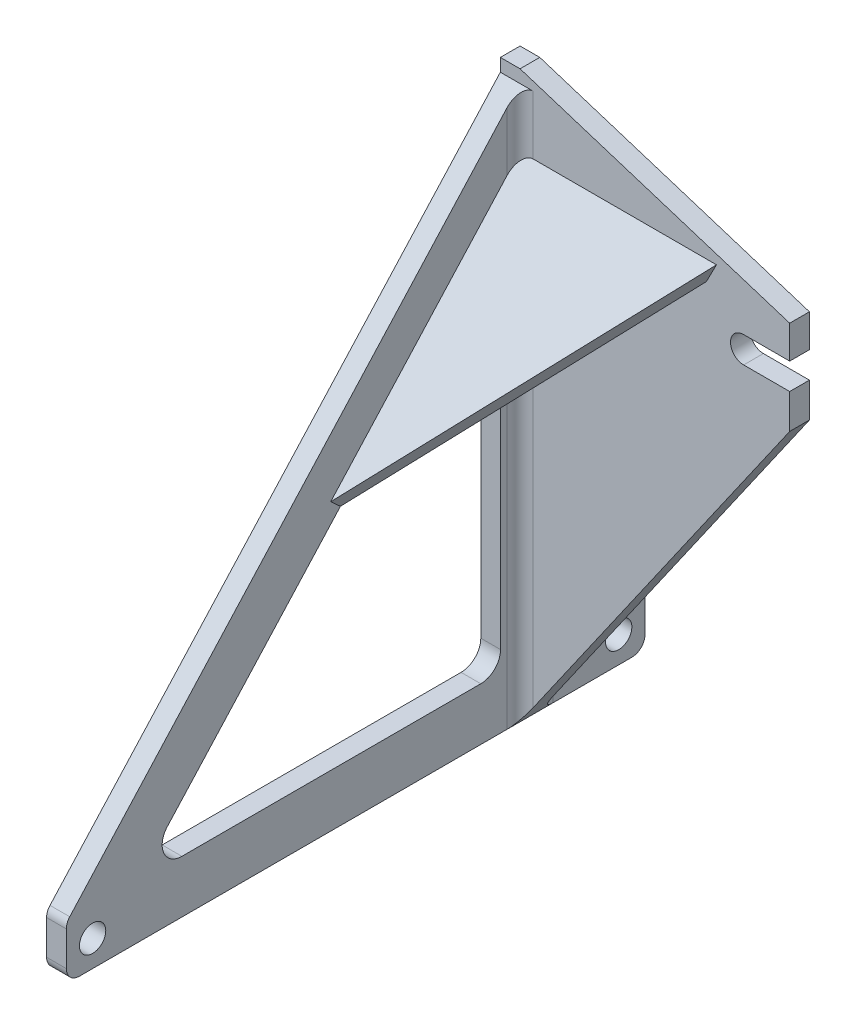
from build123d import *

# Parameters (mm, degrees)
SKETCH_1_R          = 2
EXTRUDE_1_DEPTH     = 3
SKETCH_2_W          = 3
SKETCH_2_H          = 86
EXTRUDE_2_DEPTH     = 44
CUT_EXTRUDE_1_DEPTH = 3
FILLET_1_R          = 2
RIB_2_REACH         = 105.226
SKETCH_8_WALL_W     = 259.89004629
SKETCH_8_WALL_H     = 2
FILLET_2_R          = 2


with BuildPart() as part:
    # Эскиз1 → Бобышка-Вытянуть1 (new body)
    with BuildSketch(Plane(origin=(0, 0, 0), x_dir=(0, 0, -1), z_dir=(1, 0, 0))):
        Polygon((-44, 0), (44, 0), (44, 8), (25, 84.048968678), (-44, 8), align=None)
        with Locations((-40, 4)):
            Circle(SKETCH_1_R, mode=Mode.SUBTRACT)
        with Locations((40, 4)):
            Circle(SKETCH_1_R, mode=Mode.SUBTRACT)
        with BuildLine():
            Line((-28.646958906, 13.01585119), (16.806444582, 63.112727395))
            ThreePointArc((16.806444582, 63.112727395), (20.10865764, 63.895569238), (22.028233046, 61.096876205))
            Line((22.028233046, 61.096876205), (22.028233046, 11))
            ThreePointArc((22.028233046, 11), (21.14955339, 8.878679656), (19.028233046, 8))
            Line((19.028233046, 8), (-26.425170442, 8))
            ThreePointArc((-26.425170442, 8), (-29.168120821, 9.785000735), (-28.646958906, 13.01585119))
        make_face(mode=Mode.SUBTRACT)
    extrude(amount=EXTRUDE_1_DEPTH)

    # Эскиз2 → Бобышка-Вытянуть2 (add)
    with BuildSketch(Plane(origin=(0, 0, 0), x_dir=(0, 0, -1), z_dir=(1, 0, 0))):
        with Locations((26.5, 43)):
            Rectangle(SKETCH_2_W, SKETCH_2_H)
    extrude(amount=EXTRUDE_2_DEPTH)

    # Эскиз3 → Вырез-Вытянуть1 (cut)
    with BuildSketch(Plane.XY.offset(-25)):
        with BuildLine():
            Line((3, 86), (44, 73))
            Line((44, 73), (44, 68))
            Line((44, 68), (37, 68))
            ThreePointArc((37, 68), (35, 66), (37, 64))
            Line((37, 64), (44, 64))
            Line((44, 64), (47.670015823, 64))
            Line((47.670015823, 64), (3, 0))
            Line((3, 0), (48.684950213, 0))
            Line((48.684950213, 0), (53.414147697, 0))
            Line((53.414147697, 0), (53.414147697, 86))
            Line((53.414147697, 86), (3, 86))
        make_face()
    extrude(amount=-CUT_EXTRUDE_1_DEPTH, mode=Mode.SUBTRACT)

    # Скругление1
    fillet_1_edges = [part.edges().sort_by_distance(p)[0] for p in [
        (3, 36.020618391, -28),
        (3, 42.024484339, -25),
    ]]
    fillet(fillet_1_edges, radius=FILLET_1_R)

    # Эскиз8 wall → Ребро2 (add, up to next)
    with BuildSketch(Plane(origin=(17.70715676, 57.665222316, -11.863868016), x_dir=(0.571832945578, 0.60756293308, -0.551248006526), z_dir=(0.82037008865, -0.42349728062, 0.384243374641)), mode=Mode.PRIVATE) as rib_2_sk1:
        with Locations((0, 1)):
            Rectangle(SKETCH_8_WALL_W, SKETCH_8_WALL_H)
    rib_2_tool1 = extrude(rib_2_sk1.sketch, amount=-RIB_2_REACH, mode=Mode.PRIVATE) - part.part
    add(rib_2_tool1.solids().sort_by_distance((17.70715676, 57.665222316, -11.863868016))[0])

    # Скругление2
    fillet_2_edges = [part.edges().sort_by_distance(p)[0] for p in [
        (1.5, 8, -44),
        (1.5, 0, -44),
        (1.5, 8, 44),
        (1.5, 0, 44),
    ]]
    fillet(fillet_2_edges, radius=FILLET_2_R)


solid = part.part
